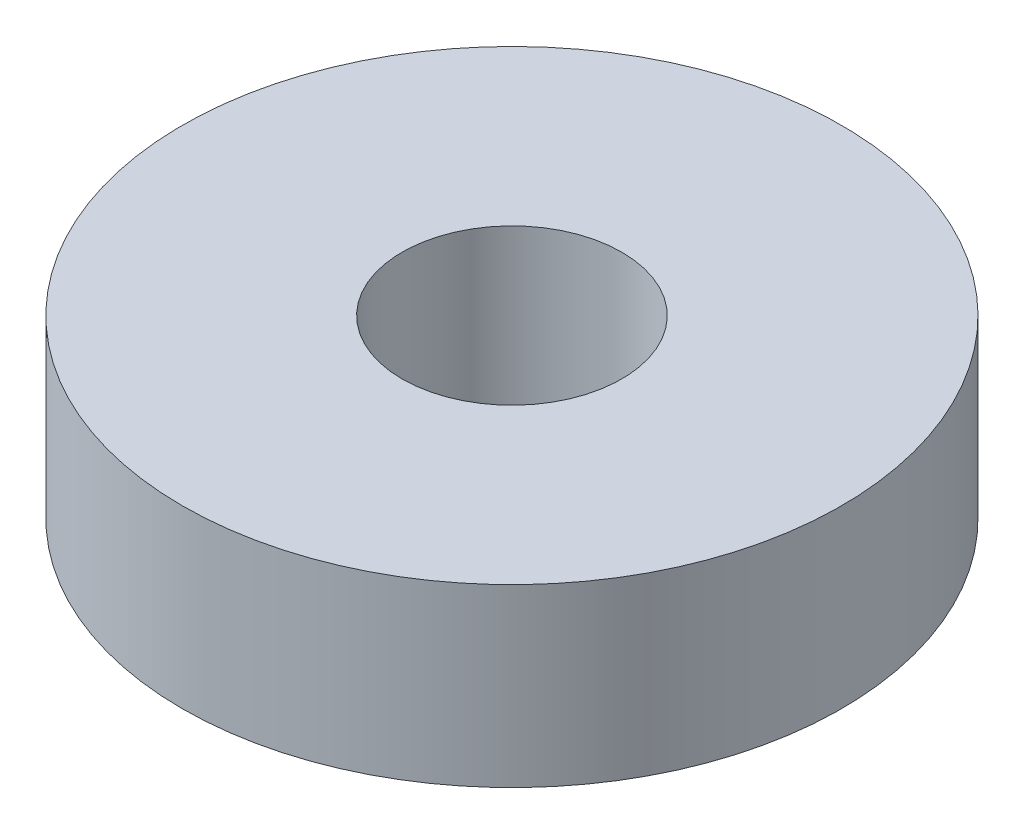
from build123d import *

# Parameters (mm, degrees)
SKETCH_1_R      = 7.5
SKETCH_1_R_2    = 2.5
EXTRUDE_1_DEPTH = 4


with BuildPart() as part:
    # 草图1 → 凸台-拉伸1 (new body)
    with BuildSketch(Plane(origin=(0, 0, 0), x_dir=(1, 0, 0), z_dir=(0, 1, 0))):
        with Locations(Location((0, 0, 0), (0, 0, 270))):
            Circle(SKETCH_1_R)
        with Locations(Location((0, 0, 0), (0, 0, 270))):
            Circle(SKETCH_1_R_2, mode=Mode.SUBTRACT)
    extrude(amount=EXTRUDE_1_DEPTH)


solid = part.part
